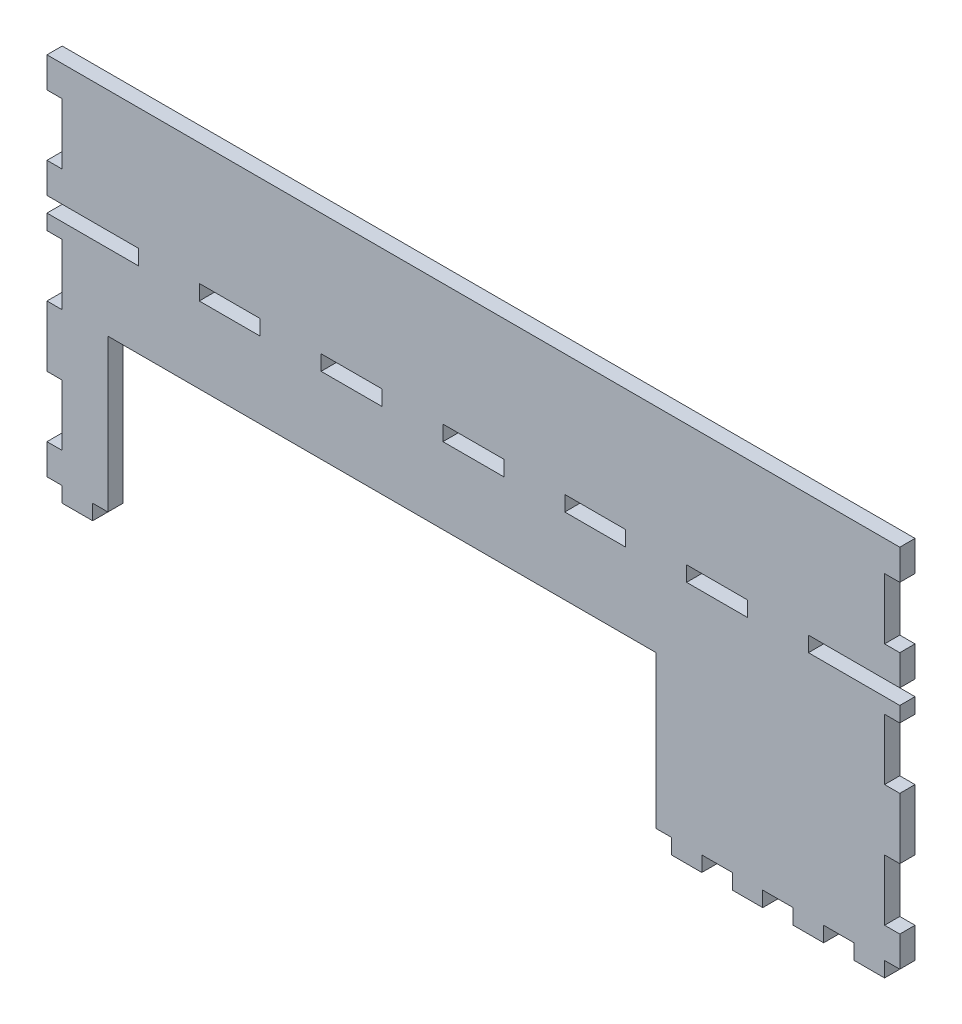
from build123d import *

# Parameters (mm, degrees)
ESQUISSE1_W                = 355.6
ESQUISSE1_H                = 152.4
BOSS_EXTRU_1_DEPTH         = 6.35
ESQUISSE3_W                = 6.35
ESQUISSE3_H                = 25.4
ENL_V_MAT_EXTRU_2_DEPTH    = 6.35
R_P_TITION_LIN_AIRE2_COUNT = 3
R_P_TITION_LIN_AIRE2_PITCH = 50.8
SYM_TRIE1_COPY_1_SKETCH_W  = 6.35
SYM_TRIE1_COPY_1_SKETCH_H  = 25.4
SYM_TRIE1_COPY_1_DEPTH     = 6.35
SYM_TRIE1_COPY_2_SKETCH_W  = 6.35
SYM_TRIE1_COPY_2_SKETCH_H  = 25.4
SYM_TRIE1_COPY_2_DEPTH     = 6.35
CUT_EXTRUDE1_REACH         = 195.545
SKETCH1_W                  = 228.6
SKETCH1_H                  = 63.5
ESQUISSE5_W                = 38.1
ESQUISSE5_H                = 6.35
ENL_V_MAT_EXTRU_4_DEPTH    = 6.35
ESQUISSE6_W                = 25.4
ESQUISSE6_H                = 6.35
ENL_V_MAT_EXTRU_5_DEPTH    = 6.35
R_P_TITION_LIN_AIRE3_COUNT = 5
R_P_TITION_LIN_AIRE3_PITCH = 50.8
ESQUISSE8_W                = 12.7
ESQUISSE8_H                = 6.35
BOSS_EXTRU_2_DEPTH         = 6.35


with BuildPart() as part:
    # Esquisse1 → Boss.-Extru.1 (new body)
    with BuildSketch(Plane.XY):
        Rectangle(ESQUISSE1_W, ESQUISSE1_H)
    extrude(amount=BOSS_EXTRU_1_DEPTH)

    # Esquisse3 → Enlèv. mat.-Extru.2 (cut)
    with BuildSketch(Plane.XY.offset(6.35)):
        with Locations((-174.625, 50.8)):
            Rectangle(ESQUISSE3_W, ESQUISSE3_H)
    enl_v_mat_extru_2 = extrude(amount=-ENL_V_MAT_EXTRU_2_DEPTH, mode=Mode.SUBTRACT)

    # Répétition linéaire2: Enlèv. mat.-Extru.2 ×3
    with Locations(*[(0, -i * R_P_TITION_LIN_AIRE2_PITCH, 0) for i in range(1, R_P_TITION_LIN_AIRE2_COUNT)]):
        add(enl_v_mat_extru_2, mode=Mode.SUBTRACT)

    # Symétrie1: Enlèv. mat.-Extru.2 across plane
    add(enl_v_mat_extru_2.mirror(Plane(origin=(0, 0, 0), x_dir=(0, 0, 1), z_dir=(1, 0, 0))), mode=Mode.SUBTRACT)

    # Symétrie1 copy 1 sketch → Symétrie1 copy 1 (cut)
    with BuildSketch(Plane(origin=(0, -50.8, 6.35), x_dir=(-1, 0, 0), z_dir=(0, 0, 1))):
        with Locations((-174.625, -50.8)):
            Rectangle(SYM_TRIE1_COPY_1_SKETCH_W, SYM_TRIE1_COPY_1_SKETCH_H)
    extrude(amount=-SYM_TRIE1_COPY_1_DEPTH, mode=Mode.SUBTRACT)

    # Symétrie1 copy 2 sketch → Symétrie1 copy 2 (cut)
    with BuildSketch(Plane(origin=(0, -101.6, 6.35), x_dir=(-1, 0, 0), z_dir=(0, 0, 1))):
        with Locations((-174.625, -50.8)):
            Rectangle(SYM_TRIE1_COPY_2_SKETCH_W, SYM_TRIE1_COPY_2_SKETCH_H)
    extrude(amount=-SYM_TRIE1_COPY_2_DEPTH, mode=Mode.SUBTRACT)

    # Sketch1 → Cut-Extrude1 (cut, up to next)
    with BuildSketch(Plane.XY.offset(6.35), mode=Mode.PRIVATE) as cut_extrude1_sk1:
        with Locations((-38.1, -44.45)):
            Rectangle(SKETCH1_W, SKETCH1_H)
    cut_extrude1_tool1 = extrude(cut_extrude1_sk1.sketch, amount=-CUT_EXTRUDE1_REACH, mode=Mode.PRIVATE) & part.part
    add(cut_extrude1_tool1.solids().sort_by_distance((-38.1, -44.45, 6.35))[0], mode=Mode.SUBTRACT)

    # Esquisse5 → Enlèv. mat.-Extru.4 (cut)
    with BuildSketch(Plane.XY.offset(6.35)):
        with Locations((-158.75, 22.225)):
            Rectangle(ESQUISSE5_W, ESQUISSE5_H)
    enl_v_mat_extru_4 = extrude(amount=-ENL_V_MAT_EXTRU_4_DEPTH, mode=Mode.SUBTRACT)

    # Symétrie2: Enlèv. mat.-Extru.4 across plane
    add(enl_v_mat_extru_4.mirror(Plane(origin=(0, 0, 0), x_dir=(0, 0, 1), z_dir=(1, 0, 0))), mode=Mode.SUBTRACT)

    # Esquisse6 → Enlèv. mat.-Extru.5 (cut)
    with BuildSketch(Plane.XY.offset(6.35)):
        with Locations((-101.6, 22.225)):
            Rectangle(ESQUISSE6_W, ESQUISSE6_H)
    enl_v_mat_extru_5 = extrude(amount=-ENL_V_MAT_EXTRU_5_DEPTH, mode=Mode.SUBTRACT)

    # Répétition linéaire3: Enlèv. mat.-Extru.5 ×5
    with Locations(*[(i * R_P_TITION_LIN_AIRE3_PITCH, 0, 0) for i in range(1, R_P_TITION_LIN_AIRE3_COUNT)]):
        add(enl_v_mat_extru_5, mode=Mode.SUBTRACT)

    # Esquisse8 → Boss.-Extru.2 (add)
    with BuildSketch(Plane.XY.offset(6.35)):
        with Locations((-165.1, -79.375)):
            Rectangle(ESQUISSE8_W, ESQUISSE8_H)
        with Locations((88.9, -79.375)):
            Rectangle(ESQUISSE8_W, ESQUISSE8_H)
        with Locations((114.3, -79.375)):
            Rectangle(ESQUISSE8_W, ESQUISSE8_H)
        with Locations((139.7, -79.375)):
            Rectangle(ESQUISSE8_W, ESQUISSE8_H)
        with Locations((165.1, -79.375)):
            Rectangle(ESQUISSE8_W, ESQUISSE8_H)
    extrude(amount=-BOSS_EXTRU_2_DEPTH)


solid = part.part
